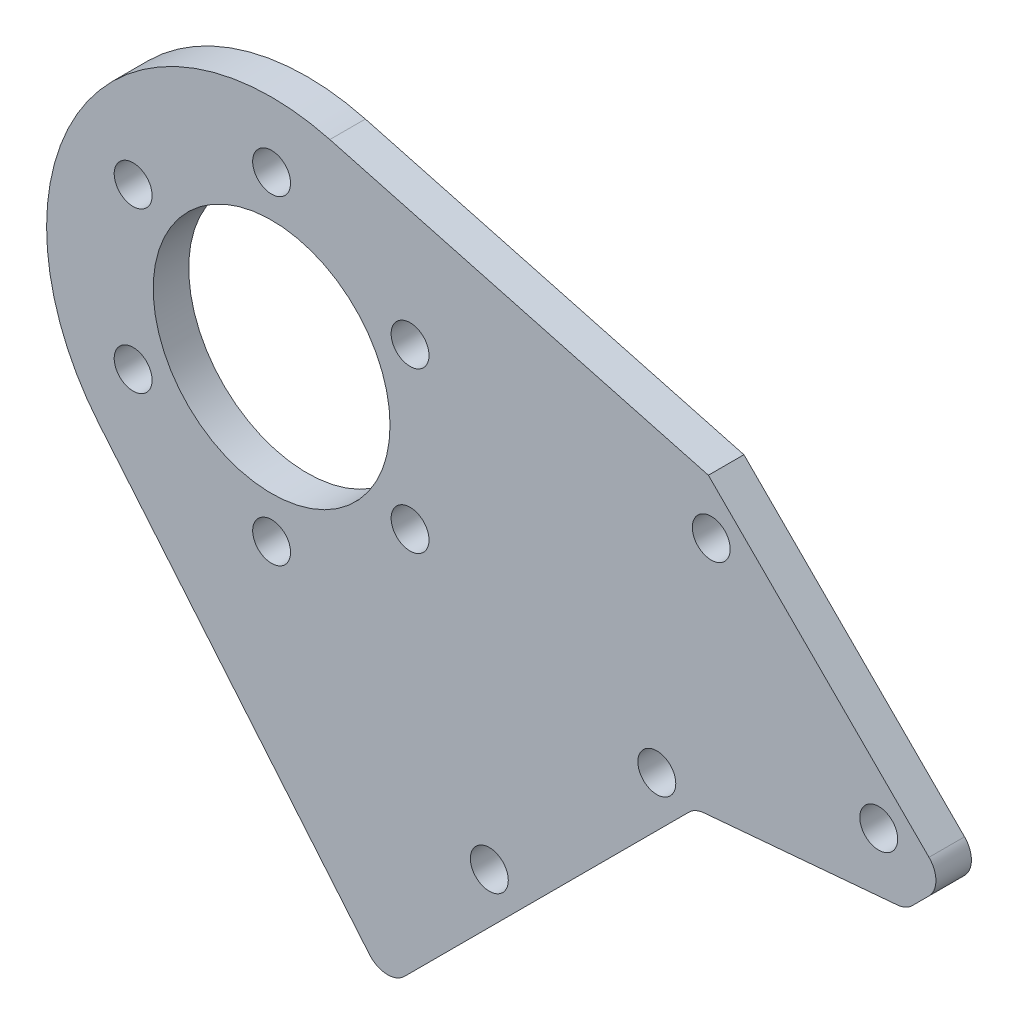
from build123d import *

# Parameters (mm, degrees)
SKETCH_1_R          = 19
SKETCH_1_R_2        = 1.6
SKETCH_1_R_3        = 10
EXTRUDE_1_DEPTH     = 3
EXTRUDE_START       = -3
SKETCH_2_R          = 1.6
EXTRUDE_2_DEPTH     = 3
CUT_EXTRUDE_START   = -10
CUT_EXTRUDE_1_DEPTH = 10
EXTRUDE_4_DEPTH     = 3


with BuildPart() as part:
    # 草图1 → 凸台-拉伸1 (new body)
    with BuildSketch(Plane.XY):
        Circle(SKETCH_1_R)
        with Locations((0, 13.5)):
            Circle(SKETCH_1_R_2, mode=Mode.SUBTRACT)
        Circle(SKETCH_1_R_3, mode=Mode.SUBTRACT)
        with Locations((11.691342951, 6.75)):
            Circle(SKETCH_1_R_2, mode=Mode.SUBTRACT)
        with Locations((11.691342951, -6.75)):
            Circle(SKETCH_1_R_2, mode=Mode.SUBTRACT)
        with Locations((0, -13.5)):
            Circle(SKETCH_1_R_2, mode=Mode.SUBTRACT)
        with Locations((-11.691342951, -6.75)):
            Circle(SKETCH_1_R_2, mode=Mode.SUBTRACT)
        with Locations((-11.691342951, 6.75)):
            Circle(SKETCH_1_R_2, mode=Mode.SUBTRACT)
    extrude(amount=EXTRUDE_1_DEPTH)

    # 草图2 → 凸台-拉伸2 (add)
    with BuildSketch(Plane.XY.offset(3).offset(EXTRUDE_START)):
        with BuildLine():
            Line((24.748737342, 21.920310217), (55.507882323, -8.838834765))
            ThreePointArc((55.507882323, -8.838834765), (56.093668761, -10.253048327), (55.507882323, -11.66726189))
            Line((55.507882323, -11.66726189), (54.093668761, -13.081475452))
            ThreePointArc((54.093668761, -13.081475452), (53.524691722, -13.479877464), (52.853766684, -13.659651286))
            Line((52.853766684, -13.659651286), (36.481363532, -15.092050956))
            ThreePointArc((36.481363532, -15.092050956), (35.810438494, -15.271824778), (35.241461455, -15.67022679))
            Line((35.241461455, -15.67022679), (11.212279145, -39.699409101))
            ThreePointArc((11.212279145, -39.699409101), (9.707926642, -40.283163249), (8.262251105, -39.566317661))
            Line((8.262251105, -39.566317661), (-14.59023753, -12.170660163))
            ThreePointArc((-14.59023753, -12.170660163), (12.81586728, -14.026886535), (13.435028843, 13.435028843))
            Line((13.435028843, 13.435028843), (21.920310217, 21.920310217))
            ThreePointArc((21.920310217, 21.920310217), (23.334523779, 22.506096654), (24.748737342, 21.920310217))
        make_face()
        with Locations((51.265241636, -8.838834765)):
            Circle(SKETCH_2_R, mode=Mode.SUBTRACT)
        with Locations((37.123106012, 5.303300859)):
            Circle(SKETCH_2_R, mode=Mode.SUBTRACT)
        with Locations((18.384776311, -28.284271247)):
            Circle(SKETCH_2_R, mode=Mode.SUBTRACT)
        with Locations((32.526911935, -14.142135624)):
            Circle(SKETCH_2_R, mode=Mode.SUBTRACT)
    extrude(amount=EXTRUDE_2_DEPTH)

    # 草图5 → 切除-拉伸1 (cut)
    with BuildSketch(Plane.XY.offset(3).offset(CUT_EXTRUDE_START)):
        with BuildLine():
            Line((21.920310217, 21.920310217), (15.513435038, 15.513435038))
            Line((15.513435038, 15.513435038), (36.88104685, 9.788000708))
            Line((36.88104685, 9.788000708), (24.748737342, 21.920310217))
            ThreePointArc((24.748737342, 21.920310217), (23.334523779, 22.506096654), (21.920310217, 21.920310217))
        make_face()
    extrude(amount=CUT_EXTRUDE_1_DEPTH, mode=Mode.SUBTRACT)

    # 草图5<4> → 凸台-拉伸4 (add)
    with BuildSketch(Plane.XY.offset(3).offset(EXTRUDE_START)):
        with BuildLine():
            Line((15.513435038, 15.513435038), (4.917561857, 18.352590699))
            ThreePointArc((4.917561857, 18.352590699), (9.5, 16.454482672), (13.435028843, 13.435028843))
            Line((13.435028843, 13.435028843), (15.513435038, 15.513435038))
        make_face()
    extrude(amount=EXTRUDE_4_DEPTH)


solid = part.part
